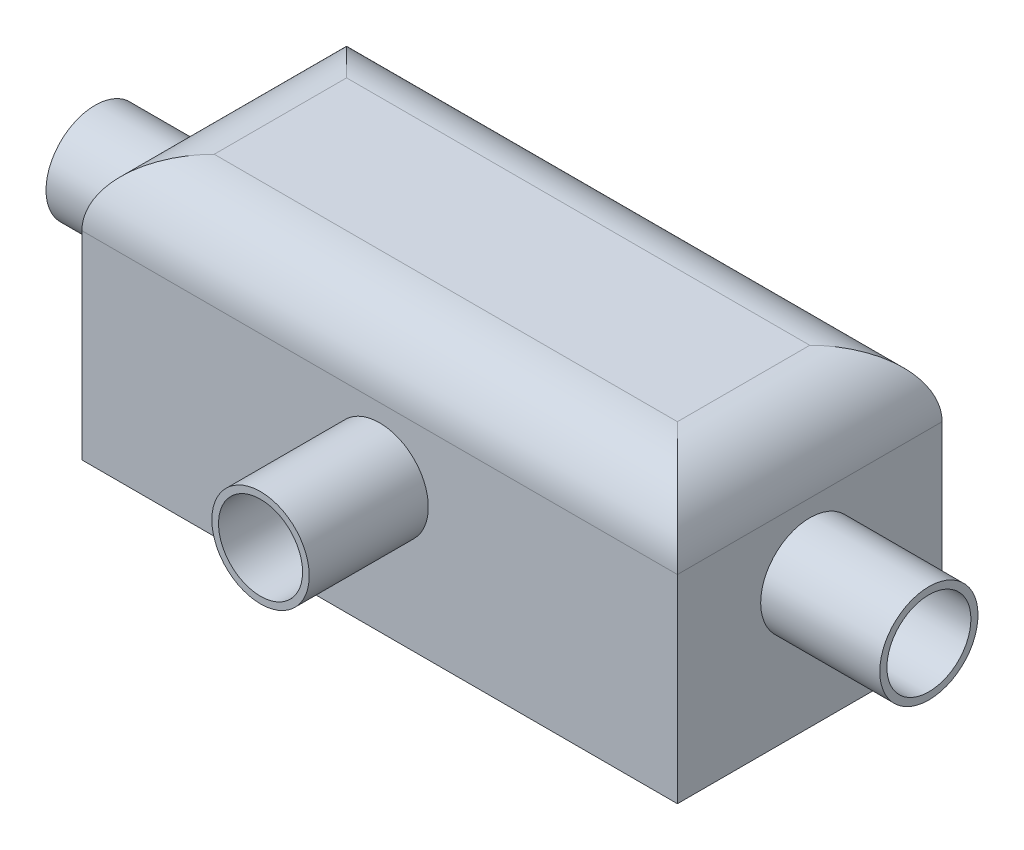
from build123d import *

# Parameters (mm, degrees)
CROQUIS1_W              = 90
CROQUIS1_H              = 40
SALIENTE_EXTRUIR1_DEPTH = 40
CROQUIS2_R              = 7.421380831
CROQUIS2_R_2            = 6.35
SALIENTE_EXTRUIR2_DEPTH = 18
SALIENTE_EXTRUIR3_START = 18
CROQUIS3_R              = 7.421380831
CROQUIS3_R_2            = 6.35
SALIENTE_EXTRUIR3_DEPTH = 18
CROQUIS4_R              = 7.356347307
CROQUIS4_R_2            = 6.35
SALIENTE_EXTRUIR4_DEPTH = 18
REDONDEO1_R             = 10


with BuildPart() as part:
    # Croquis1 → Saliente-Extruir1 (new body)
    with BuildSketch(Plane(origin=(0, 0, 0), x_dir=(1, 0, 0), z_dir=(0, 1, 0))):
        Rectangle(CROQUIS1_W, CROQUIS1_H)
    extrude(amount=SALIENTE_EXTRUIR1_DEPTH)

    # Croquis2 → Saliente-Extruir2 (add)
    with BuildSketch(Plane(origin=(45, 0, 0), x_dir=(0, 0, -1), z_dir=(1, 0, 0))):
        with Locations(Location((0, 20, 0), (0, 0, 180))):
            Circle(CROQUIS2_R)
        with Locations((0, 20)):
            Circle(CROQUIS2_R_2, mode=Mode.SUBTRACT)
    extrude(amount=SALIENTE_EXTRUIR2_DEPTH)

    # Croquis3 → Saliente-Extruir3 (add)
    with BuildSketch(Plane.ZY.offset(45).offset(SALIENTE_EXTRUIR3_START)):
        with Locations((0, 20)):
            Circle(CROQUIS3_R)
        with Locations(Location((0, 20, 0), (0, 0, 180))):
            Circle(CROQUIS3_R_2, mode=Mode.SUBTRACT)
    extrude(amount=-SALIENTE_EXTRUIR3_DEPTH)

    # Croquis4 → Saliente-Extruir4 (add)
    with BuildSketch(Plane.XY.offset(20)):
        with Locations(Location((0, 20, 0), (0, 0, 180))):
            Circle(CROQUIS4_R)
        with Locations((0, 20)):
            Circle(CROQUIS4_R_2, mode=Mode.SUBTRACT)
    extrude(amount=SALIENTE_EXTRUIR4_DEPTH)

    # Redondeo1
    redondeo1_edges = [part.edges().sort_by_distance(p)[0] for p in [
        (-45, 40, 0),
        (0, 40, 20),
        (45, 40, 0),
        (0, 40, -20),
    ]]
    fillet(redondeo1_edges, radius=REDONDEO1_R)


solid = part.part
